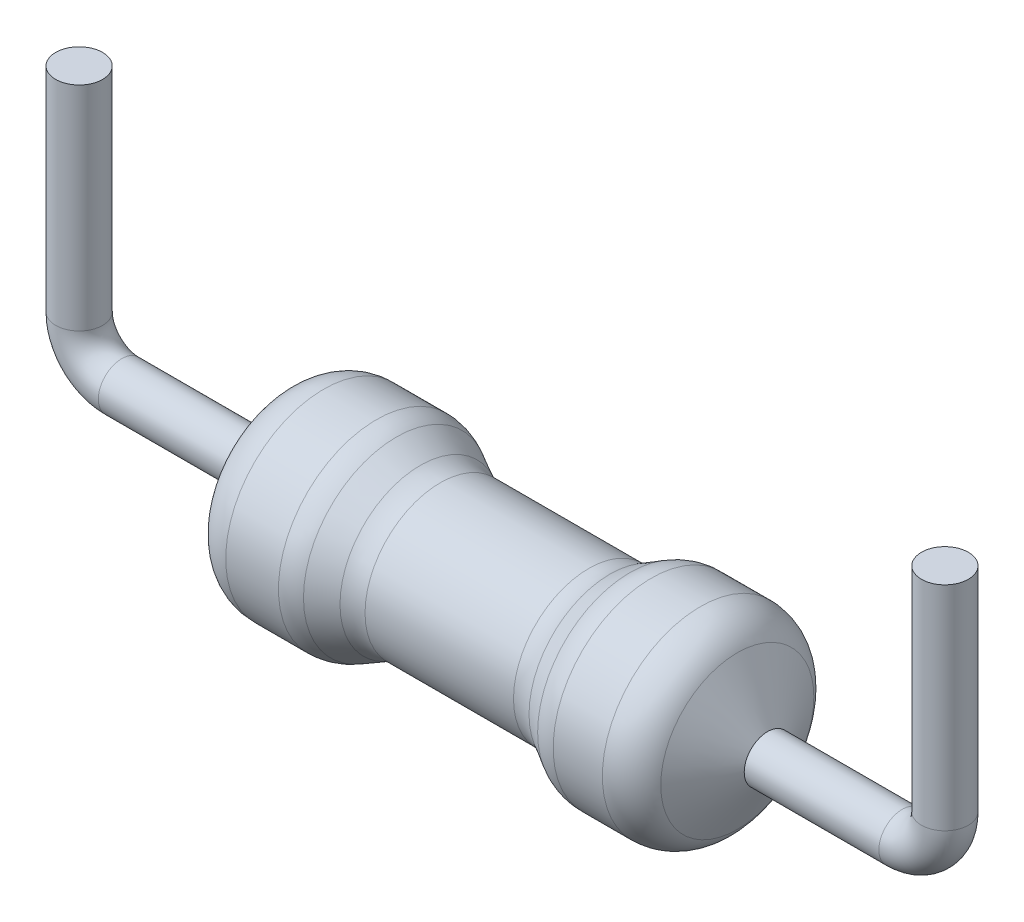
from build123d import *

# Parameters (mm, degrees)
FILLET1_R = 0.5
SKETCH4_R = 0.275


with BuildPart() as part:
    # Sketch1 → Revolve1 (revolve)
    with BuildSketch(Plane.XY, mode=Mode.PRIVATE) as revolve1_sk:
        Polygon((0, 0), (3, 0), (3, 0.275), (2.5, 1.15), (1.5, 1.15), (1.03381108, 0.883606332), (-0.96618892, 0.883606332), (-1.46618892, 1.15), (-2.5, 1.15), (-3, 0.275), (-3, 0), align=None)
    revolve(revolve1_sk.sketch.rotate(Axis((0, 0, 0), (1, 0, 0)), 90), axis=Axis((0, 0, 0), (1, 0, 0)))

    # Fillet1
    fillet1_edges = [part.edges().sort_by_distance(p)[0] for p in [
        (1.5, 0, -1.15),
        (2.5, 0, -1.15),
        (-2.5, 0, -1.15),
        (-1.46618892, 0, -1.15),
        (-0.96618892, 0, -0.883606332),
        (1.03381108, 0, -0.883606332),
    ]]
    fillet(fillet1_edges, radius=FILLET1_R)

    # Sweep1: sweep along a path in Sketch6
    with BuildLine(Plane.XY) as sweep1_path:
        Line((5.08, 3), (5.08, 0.5))
        ThreePointArc((5.08, 0.5), (4.933553391, 0.146446609), (4.58, 0))
        Line((4.58, 0), (3, 0))
        Line((3, 0), (-4.58, 0))
        ThreePointArc((-4.58, 0), (-4.933553391, 0.146446609), (-5.08, 0.5))
        Line((-5.08, 0.5), (-5.08, 3))
    # Sketch4 → Sweep1 (sweep)
    with BuildSketch(Plane(origin=(3, 0, 0), x_dir=(0, 0, -1), z_dir=(1, 0, 0))):
        Circle(SKETCH4_R)
    sweep(path=sweep1_path.line)


solid = part.part
